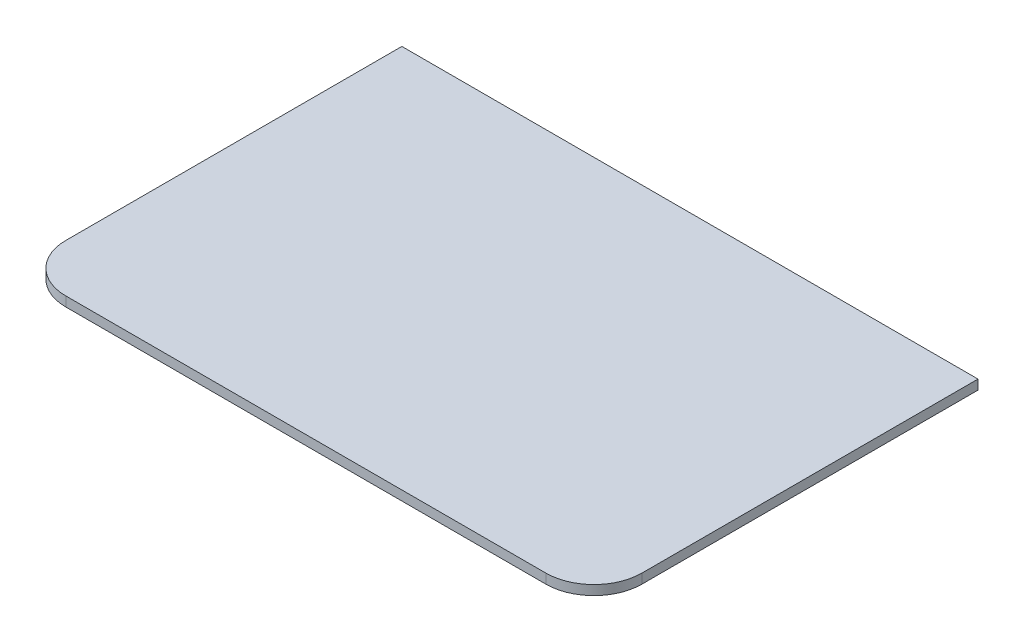
from build123d import *

# Parameters (mm, degrees)
SKETCH1_W           = 120
SKETCH1_H           = 80
BOSS_EXTRUDE1_DEPTH = 2
FILLET1_R           = 10


with BuildPart() as part:
    # Sketch1 → Boss-Extrude1 (new body)
    with BuildSketch(Plane(origin=(0, 0, 0), x_dir=(1, 0, 0), z_dir=(0, 1, 0))):
        Rectangle(SKETCH1_W, SKETCH1_H)
    extrude(amount=BOSS_EXTRUDE1_DEPTH)

    # Fillet1
    fillet1_edges = [part.edges().sort_by_distance(p)[0] for p in [
        (60, 1, 40),
        (-60, 1, 40),
    ]]
    fillet(fillet1_edges, radius=FILLET1_R)


solid = part.part
